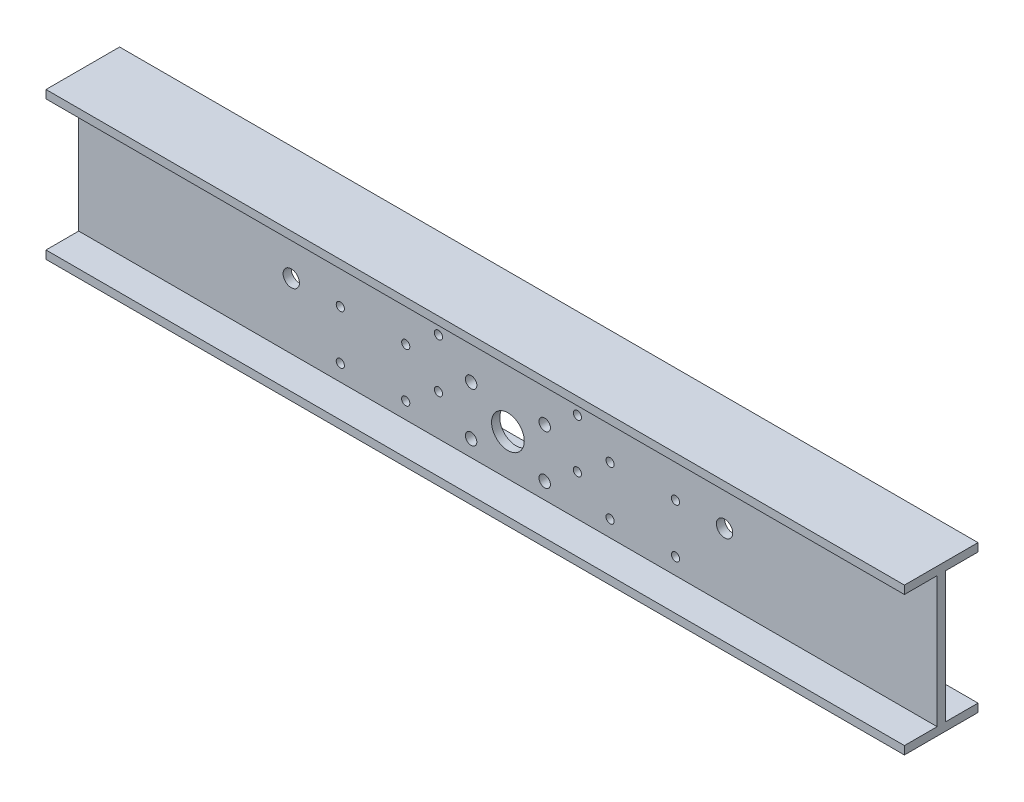
from build123d import *

# Parameters (mm, degrees)
ESQUISSE1_W        = 105
ESQUISSE1_H        = 18
ESQUISSE1_R        = 1
ESQUISSE1_R_2      = 0.5
ESQUISSE1_R_3      = 0.7
ESQUISSE1_R_4      = 2
BOSS_EXTRU_5_DEPTH = 0.5
ESQUISSE11_W       = 105
ESQUISSE11_H       = 1
BOSS_EXTRU_7_DEPTH = 4


with BuildPart() as part:
    # Esquisse1 → Boss.-Extru.5 (new body)
    with BuildSketch(Plane.XY):
        with Locations((52.5, 9)):
            Rectangle(ESQUISSE1_W, ESQUISSE1_H)
        with Locations((26, 9)):
            Circle(ESQUISSE1_R, mode=Mode.SUBTRACT)
        with Locations((32, 15)):
            Circle(ESQUISSE1_R_2, mode=Mode.SUBTRACT)
        with Locations((32, 9)):
            Circle(ESQUISSE1_R_2, mode=Mode.SUBTRACT)
        with Locations((32, 3)):
            Circle(ESQUISSE1_R_2, mode=Mode.SUBTRACT)
        with Locations((40, 15)):
            Circle(ESQUISSE1_R_2, mode=Mode.SUBTRACT)
        with Locations((40, 9)):
            Circle(ESQUISSE1_R_2, mode=Mode.SUBTRACT)
        with Locations((40, 3)):
            Circle(ESQUISSE1_R_2, mode=Mode.SUBTRACT)
        with Locations((44, 6)):
            Circle(ESQUISSE1_R_2, mode=Mode.SUBTRACT)
        with Locations((44, 12)):
            Circle(ESQUISSE1_R_2, mode=Mode.SUBTRACT)
        with Locations((48, 3)):
            Circle(ESQUISSE1_R_3, mode=Mode.SUBTRACT)
        with Locations((48, 9)):
            Circle(ESQUISSE1_R_3, mode=Mode.SUBTRACT)
        with Locations((48, 15)):
            Circle(ESQUISSE1_R_2, mode=Mode.SUBTRACT)
        with Locations((52.5, 6)):
            Circle(ESQUISSE1_R_4, mode=Mode.SUBTRACT)
        with Locations(Location((57, 15, 0), (0, 0, 180))):
            Circle(ESQUISSE1_R_2, mode=Mode.SUBTRACT)
        with Locations(Location((57, 9, 0), (0, 0, 180))):
            Circle(ESQUISSE1_R_3, mode=Mode.SUBTRACT)
        with Locations(Location((57, 3, 0), (0, 0, 180))):
            Circle(ESQUISSE1_R_3, mode=Mode.SUBTRACT)
        with Locations(Location((61, 12, 0), (0, 0, 180))):
            Circle(ESQUISSE1_R_2, mode=Mode.SUBTRACT)
        with Locations(Location((61, 6, 0), (0, 0, 180))):
            Circle(ESQUISSE1_R_2, mode=Mode.SUBTRACT)
        with Locations(Location((65, 3, 0), (0, 0, 180))):
            Circle(ESQUISSE1_R_2, mode=Mode.SUBTRACT)
        with Locations(Location((65, 9, 0), (0, 0, 180))):
            Circle(ESQUISSE1_R_2, mode=Mode.SUBTRACT)
        with Locations(Location((65, 15, 0), (0, 0, 180))):
            Circle(ESQUISSE1_R_2, mode=Mode.SUBTRACT)
        with Locations(Location((73, 3, 0), (0, 0, 180))):
            Circle(ESQUISSE1_R_2, mode=Mode.SUBTRACT)
        with Locations(Location((73, 9, 0), (0, 0, 180))):
            Circle(ESQUISSE1_R_2, mode=Mode.SUBTRACT)
        with Locations(Location((73, 15, 0), (0, 0, 180))):
            Circle(ESQUISSE1_R_2, mode=Mode.SUBTRACT)
        with Locations(Location((79, 9, 0), (0, 0, 180))):
            Circle(ESQUISSE1_R, mode=Mode.SUBTRACT)
    boss_extru_5 = extrude(amount=BOSS_EXTRU_5_DEPTH)

    # Esquisse11 → Boss.-Extru.7 (add)
    with BuildSketch(Plane.XY.offset(0.5)):
        with Locations((52.5, 0.5)):
            Rectangle(ESQUISSE11_W, ESQUISSE11_H)
        with Locations((52.5, 17.5)):
            Rectangle(ESQUISSE11_W, ESQUISSE11_H)
    boss_extru_7 = extrude(amount=BOSS_EXTRU_7_DEPTH)

    # Symétrie1: Boss.-Extru.5, Boss.-Extru.7 across plane
    add(boss_extru_5.mirror(Plane(origin=(0, 0, 0), x_dir=(1, 0, 0), z_dir=(0, 0, -1))))
    add(boss_extru_7.mirror(Plane(origin=(0, 0, 0), x_dir=(1, 0, 0), z_dir=(0, 0, -1))))


solid = part.part
